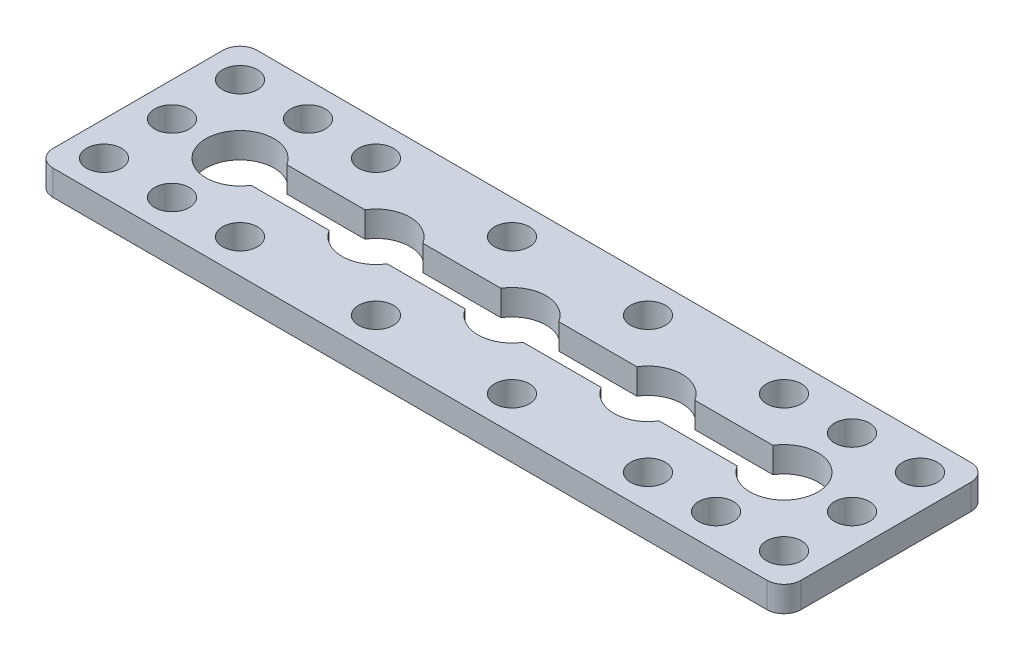
from build123d import *

# Parameters (mm, degrees)
SKETCH_1_W             = 24
SKETCH_1_H             = 3
EXTRUDE_1_DEPTH        = 88
FILLET_1_R             = 2
SKETCH_3_R             = 2.05
CUT_EXTRUDE_1_DEPTH    = 89.865066252
SKETCH_4_R             = 4
CUT_EXTRUDE_2_DEPTH    = 89.865066252
PATTERN_LINEAR_1_COUNT = 12
PATTERN_LINEAR_1_PITCH = 16
PATTERN_LINEAR_2_COUNT = 11
PATTERN_LINEAR_2_PITCH = 16
SKETCH_5_R             = 2.05
CUT_EXTRUDE_3_DEPTH    = 89.865066252
SKETCH_6_W             = 4.2
SKETCH_6_H             = 3
CUT_EXTRUDE_4_DEPTH    = 66
SKETCH_7_R             = 2.05
CUT_EXTRUDE_5_DEPTH    = 10


with BuildPart() as part:
    # 草图1 → 凸台-拉伸1 (new body)
    with BuildSketch(Plane(origin=(0, 0, 0), x_dir=(0, 0, -1), z_dir=(1, 0, 0))):
        Rectangle(SKETCH_1_W, SKETCH_1_H)
    extrude(amount=EXTRUDE_1_DEPTH)

    # 圆角1
    fillet_1_edges = [part.edges().sort_by_distance(p)[0] for p in [
        (88, 0, 12),
        (88, 0, -12),
        (0, 0, 12),
        (0, 0, -12),
    ]]
    fillet(fillet_1_edges, radius=FILLET_1_R)

    # 草图3 → 切除-拉伸1 (cut, through all)
    with BuildSketch(Plane(origin=(0, 1.5, 0), x_dir=(1, 0, 0), z_dir=(0, 1, 0))):
        with Locations(Location((4, 8, 0), (0, 0, 270))):
            Circle(SKETCH_3_R)
        with Locations(Location((4, -8, 0), (0, 0, 270))):
            Circle(SKETCH_3_R)
    cut_extrude_1 = extrude(amount=-CUT_EXTRUDE_1_DEPTH, mode=Mode.SUBTRACT)

    # 草图4 → 切除-拉伸2 (cut, through all)
    with BuildSketch(Plane(origin=(0, 1.5, 0), x_dir=(1, 0, 0), z_dir=(0, 1, 0))):
        with Locations(Location((12, 0, 0), (0, 0, 270))):
            Circle(SKETCH_4_R)
    cut_extrude_2 = extrude(amount=-CUT_EXTRUDE_2_DEPTH, mode=Mode.SUBTRACT)

    # 阵列(线性)1: 切除-拉伸1 ×12
    with Locations(*[(i * PATTERN_LINEAR_1_PITCH, 0, 0) for i in range(1, PATTERN_LINEAR_1_COUNT)]):
        add(cut_extrude_1, mode=Mode.SUBTRACT)

    # 阵列(线性)2: 切除-拉伸2 ×11
    with Locations(*[(i * PATTERN_LINEAR_2_PITCH, 0, 0) for i in range(1, PATTERN_LINEAR_2_COUNT)]):
        add(cut_extrude_2, mode=Mode.SUBTRACT)

    # 草图5 → 切除-拉伸3 (cut, through all)
    with BuildSketch(Plane(origin=(0, 1.5, 0), x_dir=(1, 0, 0), z_dir=(0, 1, 0))):
        with Locations(Location((4, 0, 0), (0, 0, 270))):
            Circle(SKETCH_5_R)
        with Locations(Location((84, 0, 0), (0, 0, 270))):
            Circle(SKETCH_5_R)
    extrude(amount=-CUT_EXTRUDE_3_DEPTH, mode=Mode.SUBTRACT)

    # 草图6 → 切除-拉伸4 (cut)
    with BuildSketch(Plane.ZY.offset(-12)):
        Rectangle(SKETCH_6_W, SKETCH_6_H)
    extrude(amount=-CUT_EXTRUDE_4_DEPTH, mode=Mode.SUBTRACT)

    # 草图7 → 切除-拉伸5 (cut)
    with BuildSketch(Plane(origin=(0, 1.5, 0), x_dir=(1, 0, 0), z_dir=(0, 1, 0))):
        with Locations(Location((12, 8, 0), (0, 0, 270))):
            Circle(SKETCH_7_R)
        with Locations(Location((12, -8, 0), (0, 0, 270))):
            Circle(SKETCH_7_R)
    cut_extrude_5 = extrude(amount=-CUT_EXTRUDE_5_DEPTH, mode=Mode.SUBTRACT)

    # 镜向1: 切除-拉伸5 across plane
    add(cut_extrude_5.mirror(Plane.ZY.offset(-44)), mode=Mode.SUBTRACT)


solid = part.part
